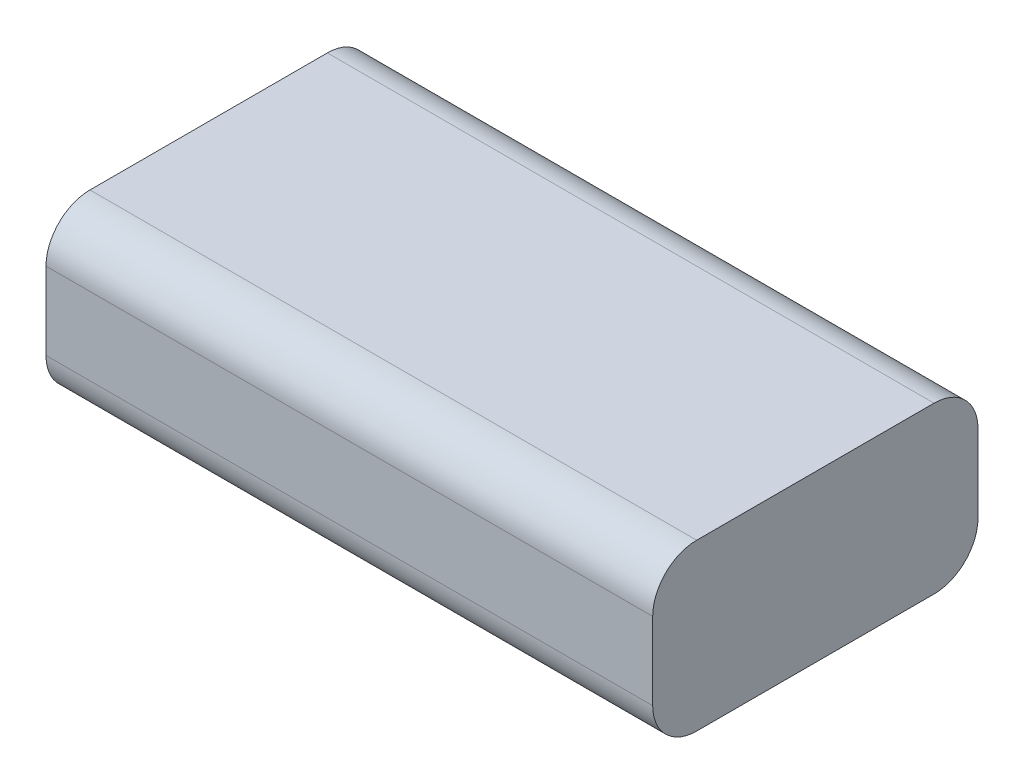
from build123d import *

# Parameters (mm, degrees)
SKETCH_1_W      = 69
SKETCH_1_H      = 37
EXTRUDE_1_DEPTH = 18.8
FILLET_1_R      = 5


with BuildPart() as part:
    # 草图1 → 凸台-拉伸1 (new body)
    with BuildSketch(Plane(origin=(0, 0, 0), x_dir=(1, 0, 0), z_dir=(0, 1, 0))):
        Rectangle(SKETCH_1_W, SKETCH_1_H)
    extrude(amount=EXTRUDE_1_DEPTH)

    # 圆角1
    fillet_1_edges = [part.edges().sort_by_distance(p)[0] for p in [
        (0, 18.8, 18.5),
        (0, 0, 18.5),
        (0, 0, -18.5),
        (0, 18.8, -18.5),
    ]]
    fillet(fillet_1_edges, radius=FILLET_1_R)


solid = part.part
